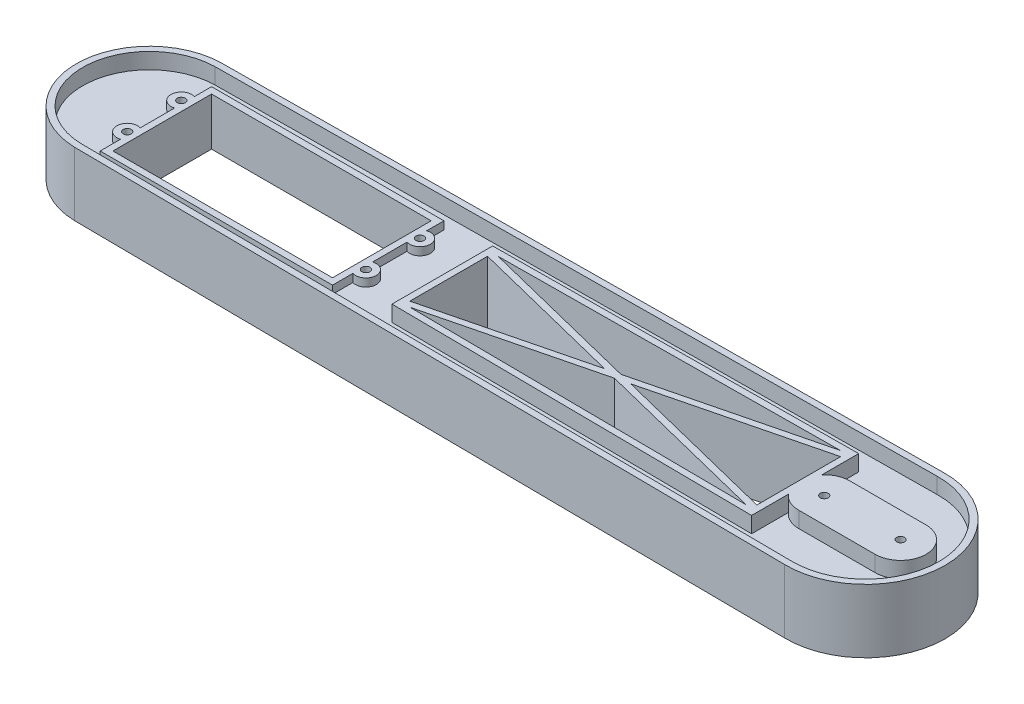
from build123d import *
from build123d.topology import SkipClean

# Parameters (mm, degrees)
SKETCH1_R           = 1.25
BOSS_EXTRUDE2_DEPTH = 10
BOSS_EXTRUDE3_START = -10
BOSS_EXTRUDE3_DEPTH = 10
SKETCH4_R           = 1.25
SKETCH4_W           = 69
SKETCH4_H           = 31
CUT_EXTRUDE1_DEPTH  = 10
SKETCH5_R           = 1.25
SKETCH5_W           = 69
SKETCH5_H           = 31
BOSS_EXTRUDE4_DEPTH = 5
SKETCH6_R           = 3.25
CUT_EXTRUDE2_DEPTH  = 5
BOSS_EXTRUDE5_START = 5
SKETCH7_R           = 1.25
SKETCH7_W           = 69
SKETCH7_H           = 31
BOSS_EXTRUDE5_DEPTH = 5
CUT_EXTRUDE3_START  = -5
SKETCH8_R           = 3.25
CUT_EXTRUDE3_DEPTH  = 5
CUT_EXTRUDE4_DEPTH  = 2.5
CUT_EXTRUDE5_START  = -2.5
CUT_EXTRUDE5_DEPTH  = 2.5
SKETCH13_R          = 1.25
BOSS_EXTRUDE6_DEPTH = 20
BOSS_EXTRUDE7_DEPTH = 20


with BuildPart() as part:
    # Sketch1 → Boss-Extrude2 (new body)
    with BuildSketch(Plane(origin=(0, 0, 0), x_dir=(1, 0, 0), z_dir=(0, 1, 0))):
        with BuildLine():
            Line((224.444444444, 24.993826398), (-0.444444444, 19.995061119))
            ThreePointArc((-0.444444444, 19.995061119), (-20, 0), (-0.444444444, -19.995061119))
            Line((-0.444444444, -19.995061119), (224.444444444, -24.993826398))
            ThreePointArc((224.444444444, -24.993826398), (250, 0), (224.444444444, 24.993826398))
        make_face()
        with Locations(Location((1, -8, 0), (0, 0, 270))):
            Circle(SKETCH1_R, mode=Mode.SUBTRACT)
        Polygon((4, -15.5), (4, 0), (4, 9), (4, 15.5), (73, 15.5), (73, -15.5), align=None, mode=Mode.SUBTRACT)
        with Locations(Location((76, -8, 0), (0, 0, 270))):
            Circle(SKETCH1_R, mode=Mode.SUBTRACT)
        Polygon((94, -12.091874906), (94, 0), (94, 12.091874906), (204, 14.53692314), (204, 0), (204, -14.53692314), align=None, mode=Mode.SUBTRACT)
        with Locations(Location((212, 0, 0), (0, 0, 270))):
            Circle(SKETCH1_R, mode=Mode.SUBTRACT)
        with Locations(Location((236, 0, 0), (0, 0, 270))):
            Circle(SKETCH1_R, mode=Mode.SUBTRACT)
        with Locations(Location((1, 9, 0), (0, 0, 270))):
            Circle(SKETCH1_R, mode=Mode.SUBTRACT)
        with Locations(Location((76, 9, 0), (0, 0, 270))):
            Circle(SKETCH1_R, mode=Mode.SUBTRACT)
    extrude(amount=BOSS_EXTRUDE2_DEPTH)

    # Sketch3 → Boss-Extrude3 (add)
    with BuildSketch(Plane(origin=(0, 10, 0), x_dir=(1, 0, 0), z_dir=(0, 1, 0)).offset(BOSS_EXTRUDE3_START)):
        with BuildLine():
            Line((-0.511111111, -22.994320286), (224.444444444, -24.993826398))
            ThreePointArc((224.444444444, -24.993826398), (250, 0), (224.444444444, 24.993826398))
            Line((224.444444444, 24.993826398), (-0.511111111, 22.994320286))
            ThreePointArc((-0.511111111, 22.994320286), (-23, 0), (-0.511111111, -22.994320286))
        make_face()
    extrude(amount=BOSS_EXTRUDE3_DEPTH)

    # Sketch4 → Cut-Extrude1 (cut)
    with BuildSketch(Plane(origin=(0, 10, 0), x_dir=(1, 0, 0), z_dir=(0, 1, 0))):
        with Locations(Location((1, 9, 0), (0, 0, 270))):
            Circle(SKETCH4_R)
        with Locations(Location((1, -8, 0), (0, 0, 270))):
            Circle(SKETCH4_R)
        with Locations(Location((76, 9, 0), (0, 0, 270))):
            Circle(SKETCH4_R)
        with Locations(Location((76, -8, 0), (0, 0, 270))):
            Circle(SKETCH4_R)
        with Locations(Location((212, 0, 0), (0, 0, 270))):
            Circle(SKETCH4_R)
        with Locations(Location((236, 0, 0), (0, 0, 270))):
            Circle(SKETCH4_R)
        with Locations((38.5, 0)):
            Rectangle(SKETCH4_W, SKETCH4_H)
        Polygon((204, -14.81171197), (204, 14.81171197), (94, 13.833982517), (94, -13.833982517), align=None)
    extrude(amount=-CUT_EXTRUDE1_DEPTH, mode=Mode.SUBTRACT)

    # Sketch5 → Boss-Extrude4 (add)
    with SkipClean():  # the faces are left unmerged after this step: merging them gives an invalid solid
        with BuildSketch(Plane.XZ):
            with BuildLine():
                Line((-0.511111111, -22.994320286), (224.444444444, -24.993826398))
                ThreePointArc((224.444444444, -24.993826398), (250, 0), (224.444444444, 24.993826398))
                Line((224.444444444, 24.993826398), (-0.511111111, 22.994320286))
                ThreePointArc((-0.511111111, 22.994320286), (-23, 0), (-0.511111111, -22.994320286))
            make_face()
            with Locations(Location((1, 8, 0), (0, 0, 90))):
                Circle(SKETCH5_R, mode=Mode.SUBTRACT)
            with Locations(Location((1, -9, 0), (0, 0, 90))):
                Circle(SKETCH5_R, mode=Mode.SUBTRACT)
            with Locations(Location((76, 8, 0), (0, 0, 90))):
                Circle(SKETCH5_R, mode=Mode.SUBTRACT)
            with Locations(Location((76, -9, 0), (0, 0, 90))):
                Circle(SKETCH5_R, mode=Mode.SUBTRACT)
            with Locations(Location((212, 0, 0), (0, 0, 90))):
                Circle(SKETCH5_R, mode=Mode.SUBTRACT)
            with Locations(Location((236, 0, 0), (0, 0, 90))):
                Circle(SKETCH5_R, mode=Mode.SUBTRACT)
            with Locations((38.5, 0)):
                Rectangle(SKETCH5_W, SKETCH5_H, mode=Mode.SUBTRACT)
            Polygon((204, -14.81171197), (94, -13.833982517), (94, 13.833982517), (204, 14.81171197), align=None, mode=Mode.SUBTRACT)
        extrude(amount=BOSS_EXTRUDE4_DEPTH)

    # Sketch6 → Cut-Extrude2 (cut)
    with SkipClean():  # the faces are left unmerged after this step: merging them gives an invalid solid
        with BuildSketch(Plane.XZ.offset(5)):
            with BuildLine():
                Line((-0.479696157, -20.994520514), (224.475834105, -22.994026401))
                ThreePointArc((224.475834105, -22.994026401), (248, 0), (224.475834105, 22.994026401))
                Line((224.475834105, 22.994026401), (-0.479696157, 20.994520514))
                ThreePointArc((-0.479696157, 20.994520514), (-21, 0), (-0.479696157, -20.994520514))
            make_face()
            with Locations(Location((212, 0, 0), (0, 0, 270))):
                Circle(SKETCH6_R, mode=Mode.SUBTRACT)
            with Locations(Location((236, 0, 0), (0, 0, 270))):
                Circle(SKETCH6_R, mode=Mode.SUBTRACT)
            with BuildLine():
                Line((2, 4.907670781), (2, -5.907670781))
                ThreePointArc((2, -5.907670781), (-2.25, -9), (2, -12.092329219))
                Line((2, -12.092329219), (2, -17.5))
                Line((2, -17.5), (75, -17.5))
                Line((75, -17.5), (75, -12.092329219))
                ThreePointArc((75, -12.092329219), (79.25, -9), (75, -5.907670781))
                Line((75, -5.907670781), (75, 4.907670781))
                ThreePointArc((75, 4.907670781), (79.25, 8), (75, 11.092329219))
                Line((75, 11.092329219), (75, 17.5))
                Line((75, 17.5), (2, 17.5))
                Line((2, 17.5), (2, 11.092329219))
                ThreePointArc((2, 11.092329219), (-2.25, 8), (2, 4.907670781))
            make_face(mode=Mode.SUBTRACT)
            Polygon((92, 15.816284621), (92, -15.816284621), (206, -16.829567872), (206, 16.829567872), align=None, mode=Mode.SUBTRACT)
        extrude(amount=-CUT_EXTRUDE2_DEPTH, mode=Mode.SUBTRACT)

    # Sketch7 → Boss-Extrude5 (add)
    with SkipClean():  # the faces are left unmerged after this step: merging them gives an invalid solid
        with BuildSketch(Plane(origin=(0, 10, 0), x_dir=(1, 0, 0), z_dir=(0, 1, 0)).offset(BOSS_EXTRUDE5_START)):
            with BuildLine():
                Line((224.444444444, 24.993826398), (-0.511111111, 22.994320286))
                ThreePointArc((-0.511111111, 22.994320286), (-23, 0), (-0.511111111, -22.994320286))
                Line((-0.511111111, -22.994320286), (224.444444444, -24.993826398))
                ThreePointArc((224.444444444, -24.993826398), (250, 0), (224.444444444, 24.993826398))
            make_face()
            with Locations(Location((212, 0, 0), (0, 0, 270))):
                Circle(SKETCH7_R, mode=Mode.SUBTRACT)
            with Locations(Location((76, 9, 0), (0, 0, 270))):
                Circle(SKETCH7_R, mode=Mode.SUBTRACT)
            with Locations(Location((76, -8, 0), (0, 0, 270))):
                Circle(SKETCH7_R, mode=Mode.SUBTRACT)
            with Locations(Location((1, 9, 0), (0, 0, 270))):
                Circle(SKETCH7_R, mode=Mode.SUBTRACT)
            with Locations(Location((1, -8, 0), (0, 0, 270))):
                Circle(SKETCH7_R, mode=Mode.SUBTRACT)
            with Locations(Location((236, 0, 0), (0, 0, 270))):
                Circle(SKETCH7_R, mode=Mode.SUBTRACT)
            with Locations((38.5, 0)):
                Rectangle(SKETCH7_W, SKETCH7_H, mode=Mode.SUBTRACT)
            Polygon((94, 13.833982517), (94, -13.833982517), (204, -14.81171197), (204, 14.81171197), align=None, mode=Mode.SUBTRACT)
        extrude(amount=-BOSS_EXTRUDE5_DEPTH)

    # Sketch8 → Cut-Extrude3 (cut)
    with SkipClean():  # the faces are left unmerged after this step: merging them gives an invalid solid
        with BuildSketch(Plane(origin=(0, 15, 0), x_dir=(1, 0, 0), z_dir=(0, 1, 0)).offset(CUT_EXTRUDE3_START)):
            with BuildLine():
                Line((224.475834105, 22.994026401), (-0.479696157, 20.994520514))
                ThreePointArc((-0.479696157, 20.994520514), (-21, 0), (-0.479696157, -20.994520514))
                Line((-0.479696157, -20.994520514), (224.475834105, -22.994026401))
                ThreePointArc((224.475834105, -22.994026401), (248, 0), (224.475834105, 22.994026401))
            make_face()
            with Locations(Location((212, 0, 0), (0, 0, 90))):
                Circle(SKETCH8_R, mode=Mode.SUBTRACT)
            with Locations(Location((236, 0, 0), (0, 0, 90))):
                Circle(SKETCH8_R, mode=Mode.SUBTRACT)
            with BuildLine():
                Line((75, -4.907670781), (75, 5.907670781))
                ThreePointArc((75, 5.907670781), (79.25, 9), (75, 12.092329219))
                Line((75, 12.092329219), (75, 17.5))
                Line((75, 17.5), (2, 17.5))
                Line((2, 17.5), (2, 12.092329219))
                ThreePointArc((2, 12.092329219), (-2.25, 9), (2, 5.907670781))
                Line((2, 5.907670781), (2, -4.907670781))
                ThreePointArc((2, -4.907670781), (-2.25, -8), (2, -11.092329219))
                Line((2, -11.092329219), (2, -17.5))
                Line((2, -17.5), (75, -17.5))
                Line((75, -17.5), (75, -11.092329219))
                ThreePointArc((75, -11.092329219), (79.25, -8), (75, -4.907670781))
            make_face(mode=Mode.SUBTRACT)
            Polygon((206, 16.829567872), (92, 15.816284621), (92, -15.816284621), (206, -16.829567872), align=None, mode=Mode.SUBTRACT)
        extrude(amount=CUT_EXTRUDE3_DEPTH, mode=Mode.SUBTRACT)

    # Sketch9 → Cut-Extrude4 (cut)
    with SkipClean():  # the faces are left unmerged after this step: merging them gives an invalid solid
        with BuildSketch(Plane.XZ.offset(5)):
            with BuildLine():
                Line((2, 17.5), (2, 11.092329219))
                ThreePointArc((2, 11.092329219), (-2.25, 8), (2, 4.907670781))
                Line((2, 4.907670781), (2, -5.907670781))
                ThreePointArc((2, -5.907670781), (-2.25, -9), (2, -12.092329219))
                Line((2, -12.092329219), (2, -17.5))
                Line((2, -17.5), (75, -17.5))
                Line((75, -17.5), (75, -12.092329219))
                ThreePointArc((75, -12.092329219), (79.25, -9), (75, -5.907670781))
                Line((75, -5.907670781), (75, 4.907670781))
                ThreePointArc((75, 4.907670781), (79.25, 8), (75, 11.092329219))
                Line((75, 11.092329219), (75, 17.5))
                Line((75, 17.5), (2, 17.5))
            make_face()
        extrude(amount=-CUT_EXTRUDE4_DEPTH, mode=Mode.SUBTRACT)

    # Sketch10 → Cut-Extrude5 (cut)
    with SkipClean():  # the faces are left unmerged after this step: merging them gives an invalid solid
        with BuildSketch(Plane(origin=(0, 15, 0), x_dir=(1, 0, 0), z_dir=(0, 1, 0)).offset(CUT_EXTRUDE5_START)):
            with BuildLine():
                Line((75, -4.907670781), (75, 5.907670781))
                ThreePointArc((75, 5.907670781), (79.25, 9), (75, 12.092329219))
                Line((75, 12.092329219), (75, 17.5))
                Line((75, 17.5), (2, 17.5))
                Line((2, 17.5), (2, 12.092329219))
                ThreePointArc((2, 12.092329219), (-2.25, 9), (2, 5.907670781))
                Line((2, 5.907670781), (2, -4.907670781))
                ThreePointArc((2, -4.907670781), (-2.25, -8), (2, -11.092329219))
                Line((2, -11.092329219), (2, -17.5))
                Line((2, -17.5), (75, -17.5))
                Line((75, -17.5), (75, -11.092329219))
                ThreePointArc((75, -11.092329219), (79.25, -8), (75, -4.907670781))
            make_face()
        extrude(amount=CUT_EXTRUDE5_DEPTH, mode=Mode.SUBTRACT)

    # Sketch13 → Boss-Extrude6 (add)
    with SkipClean():  # the faces are left unmerged after this step: merging them gives an invalid solid
        with BuildSketch(Plane(origin=(0, 15, 0), x_dir=(1, 0, 0), z_dir=(0, 1, 0))):
            with BuildLine():
                Line((212, 8), (236, 8))
                ThreePointArc((236, 8), (244, 0), (236, -8))
                Line((236, -8), (212, -8))
                ThreePointArc((212, -8), (204, 0), (212, 8))
            make_face()
            with Locations(Location((236, 0, 0), (0, 0, 270))):
                Circle(SKETCH13_R, mode=Mode.SUBTRACT)
            with Locations(Location((212, 0, 0), (0, 0, 270))):
                Circle(SKETCH13_R, mode=Mode.SUBTRACT)
        extrude(amount=-BOSS_EXTRUDE6_DEPTH)

    # Sketch16 → Boss-Extrude7 (add)
    with SkipClean():  # the faces are left unmerged after this step: merging them gives an invalid solid
        with BuildSketch(Plane(origin=(0, 15, 0), x_dir=(1, 0, 0), z_dir=(0, 1, 0))):
            Polygon((94, 12.214798443), (142.969270097, 0), (94, -12.214798443), (94, -13.833982517), (95.711386414, -13.849194089), (147.101118952, -1.030640254), (202.288613586, -14.796500398), (204, -14.81171197), (204, -13.162104753), (151.232967807, 0), (204, 13.162104753), (204, 14.81171197), (202.288613586, 14.796500398), (147.101118952, 1.030640254), (95.711386414, 13.849194089), (94, 13.833982517), align=None)
        extrude(amount=-BOSS_EXTRUDE7_DEPTH)


solid = part.part
